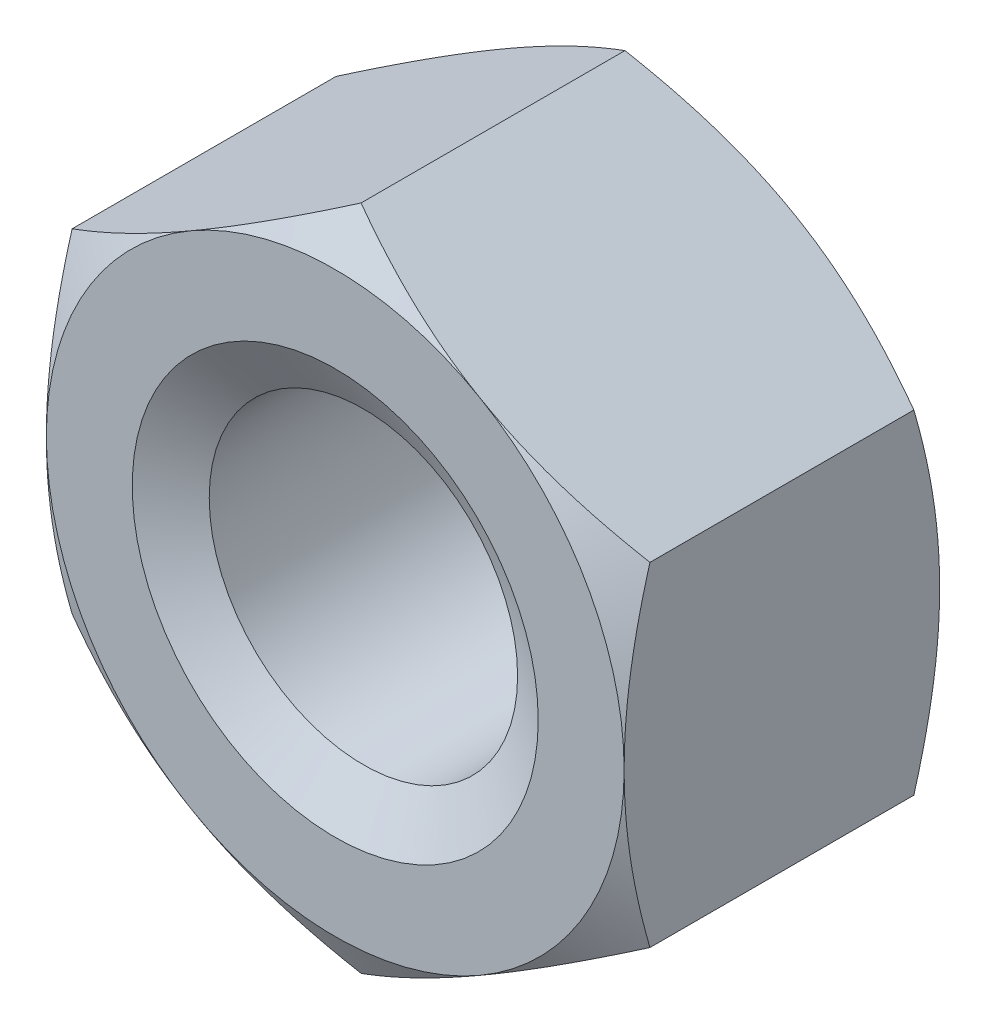
from build123d import *

# Parameters (mm, degrees)
SKETCH_3_R          = 3.3234375
EXTRUDE_1_DEPTH     = 6.8
SKETCH_5_R          = 10.785
SKETCH_5_R_2        = 6.226722653
CUT_EXTRUDE_1_DEPTH = 1.36
CUT_EXTRUDE_1_DRAFT = -60
SKETCH_7_R          = 10.785
SKETCH_7_R_2        = 6.226722653
CUT_EXTRUDE_2_DEPTH = 1.36
CUT_EXTRUDE_2_DRAFT = -60


with BuildPart() as part:
    # 草图3 → 凸台-拉伸1 (new body)
    with BuildSketch(Plane.XY):
        Polygon((0, 7.19), (-6.226722653, 3.595), (-6.226722653, -3.595), (0, -7.19), (6.226722653, -3.595), (6.226722653, 3.595), align=None)
        Circle(SKETCH_3_R, mode=Mode.SUBTRACT)
    extrude(amount=-EXTRUDE_1_DEPTH)

    # 草图4 → 切除-旋转1 (revolve, cut)
    with BuildSketch(Plane(origin=(0, 0, 0), x_dir=(0, 0, -1), z_dir=(1, 0, 0)), mode=Mode.PRIVATE) as cut_revolve_1_sk:
        Polygon((0, 4.375), (0.607119892, 3.3234375), (0.607119892, 0), (0, 0), align=None)
        Polygon((6.8, 0), (6.8, 4.375), (6.192880108, 3.3234375), (6.192880108, 0), align=None)
    revolve(cut_revolve_1_sk.sketch.rotate(Axis((0, 0, 0), (0, 0, -1)), 90), axis=Axis((0, 0, 0), (0, 0, -1)), mode=Mode.SUBTRACT)


with BuildPart() as cut_extrude_1_tool:
    # 草图5 → 切除-拉伸1 (with draft: the straight prism first)
    with BuildSketch(Plane.XY):
        Circle(SKETCH_5_R)
        Circle(SKETCH_5_R_2, mode=Mode.SUBTRACT)
    extrude(amount=-CUT_EXTRUDE_1_DEPTH)
    # 切除-拉伸1: the draft: its side faces are tilted about the plane it starts from
    cut_extrude_1_sides = [cut_extrude_1_tool.faces().sort_by_distance(p)[0] for p in [
        (-10.785, 0, -0.68),
        (-6.226722653, 0, -0.68),
    ]]
    draft(cut_extrude_1_sides, Plane.XY, CUT_EXTRUDE_1_DRAFT)


with BuildPart() as part_1:
    add(part.part)

    # 切除-拉伸1: cut by cut_extrude_1_tool
    add(cut_extrude_1_tool.part, mode=Mode.SUBTRACT)


with BuildPart() as cut_extrude_2_tool:
    # 草图7 → 切除-拉伸2 (with draft: the straight prism first)
    with BuildSketch(Plane(origin=(0, 0, -6.8), x_dir=(-1, 0, 0), z_dir=(0, 0, -1))):
        Circle(SKETCH_7_R)
        Circle(SKETCH_7_R_2, mode=Mode.SUBTRACT)
    extrude(amount=-CUT_EXTRUDE_2_DEPTH)
    # 切除-拉伸2: the draft: its side faces are tilted about the plane it starts from
    cut_extrude_2_sides = [cut_extrude_2_tool.faces().sort_by_distance(p)[0] for p in [
        (10.785, 0, -6.12),
        (6.226722653, 0, -6.12),
    ]]
    draft(cut_extrude_2_sides, Plane(origin=(0, 0, -6.8), x_dir=(-1, 0, 0), z_dir=(0, 0, -1)), CUT_EXTRUDE_2_DRAFT)


with BuildPart() as part_2:
    add(part_1.part)

    # 切除-拉伸2: cut by cut_extrude_2_tool
    add(cut_extrude_2_tool.part, mode=Mode.SUBTRACT)


solid = part_2.part
